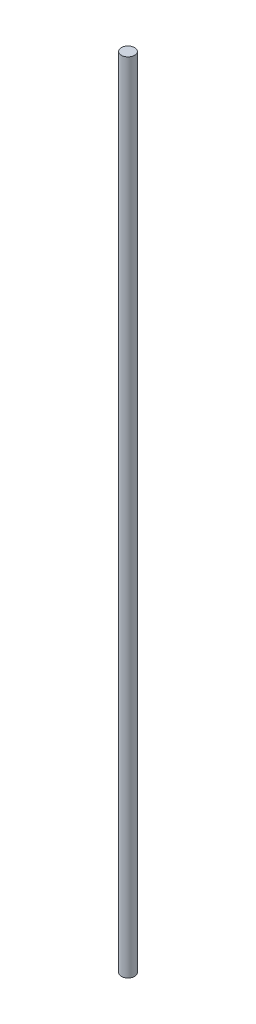
from build123d import *

# Parameters (mm, degrees)
ESBO_O1_R                = 2.5
RESSALTO_EXTRUS_O1_DEPTH = 299


with BuildPart() as part:
    # Esboço1 → Ressalto-extrusão1 (new body)
    with BuildSketch(Plane(origin=(0, 0, 0), x_dir=(1, 0, 0), z_dir=(0, 1, 0))):
        with Locations(Location((0, 0, 0), (0, 0, 270))):
            Circle(ESBO_O1_R)
    extrude(amount=RESSALTO_EXTRUS_O1_DEPTH)


solid = part.part
